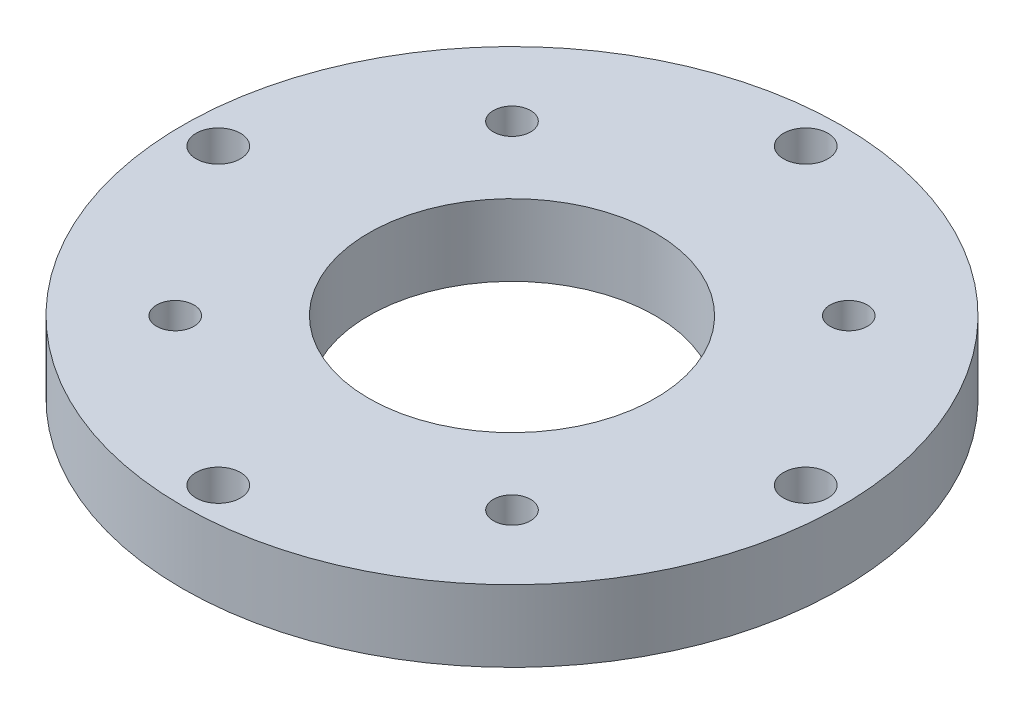
from build123d import *

# Parameters (mm, degrees)
SKETCH_1_R      = 46
SKETCH_1_R_2    = 20
SKETCH_1_R_3    = 3.1
EXTRUDE_1_DEPTH = 4
EXTRUDE_START   = 4
SKETCH_1_8_R    = 46
SKETCH_1_8_R_2  = 3.1
SKETCH_1_8_R_3  = 20
SKETCH_1_8_R_4  = 2.6
EXTRUDE_3_DEPTH = 6


with BuildPart() as part:
    # 草图1 → 凸台-拉伸1 (new body)
    with BuildSketch(Plane(origin=(0, 0, 0), x_dir=(1, 0, 0), z_dir=(0, 1, 0))):
        with Locations(Location((0, 0, 0), (0, 0, 270))):
            Circle(SKETCH_1_R)
        with Locations(Location((0, 0, 0), (0, 0, 270))):
            Circle(SKETCH_1_R_2, mode=Mode.SUBTRACT)
        with Locations(Location((0, 41, 0), (0, 0, 270))):
            Circle(SKETCH_1_R_3, mode=Mode.SUBTRACT)
        with Locations(Location((41, 0, 0), (0, 0, 270))):
            Circle(SKETCH_1_R_3, mode=Mode.SUBTRACT)
        with Locations(Location((0, -41, 0), (0, 0, 270))):
            Circle(SKETCH_1_R_3, mode=Mode.SUBTRACT)
        with Locations(Location((-41, 0, 0), (0, 0, 270))):
            Circle(SKETCH_1_R_3, mode=Mode.SUBTRACT)
        Polygon((-19.45, 21.16173141), (-19.45, 25.83826859), (-23.5, 28.17653718), (-27.55, 25.83826859), (-27.55, 21.16173141), (-23.5, 18.82346282), align=None, mode=Mode.SUBTRACT)
        Polygon((21.16173141, 19.45), (25.83826859, 19.45), (28.17653718, 23.5), (25.83826859, 27.55), (21.16173141, 27.55), (18.82346282, 23.5), align=None, mode=Mode.SUBTRACT)
        Polygon((19.45, -21.16173141), (19.45, -25.83826859), (23.5, -28.17653718), (27.55, -25.83826859), (27.55, -21.16173141), (23.5, -18.82346282), align=None, mode=Mode.SUBTRACT)
        Polygon((-21.16173141, -19.45), (-25.83826859, -19.45), (-28.17653718, -23.5), (-25.83826859, -27.55), (-21.16173141, -27.55), (-18.82346282, -23.5), align=None, mode=Mode.SUBTRACT)
    extrude(amount=EXTRUDE_1_DEPTH)

    # 草图1<8> → 凸台-拉伸3 (add)
    # profile 1 of 5: a face of its own
    with BuildSketch(Plane(origin=(0, 0, 0), x_dir=(1, 0, 0), z_dir=(0, 1, 0)).offset(EXTRUDE_START)):
        with Locations(Location((0, 0, 0), (0, 0, 270))):
            Circle(SKETCH_1_8_R)
        with Locations(Location((-41, 0, 0), (0, 0, 270))):
            Circle(SKETCH_1_8_R_2, mode=Mode.SUBTRACT)
        with Locations(Location((0, -41, 0), (0, 0, 270))):
            Circle(SKETCH_1_8_R_2, mode=Mode.SUBTRACT)
        with Locations(Location((41, 0, 0), (0, 0, 270))):
            Circle(SKETCH_1_8_R_2, mode=Mode.SUBTRACT)
        with Locations(Location((0, 41, 0), (0, 0, 270))):
            Circle(SKETCH_1_8_R_2, mode=Mode.SUBTRACT)
        with Locations(Location((0, 0, 0), (0, 0, 270))):
            Circle(SKETCH_1_8_R_3, mode=Mode.SUBTRACT)
        Polygon((-23.5, 18.82346282), (-19.45, 21.16173141), (-19.45, 25.83826859), (-23.5, 28.17653718), (-27.55, 25.83826859), (-27.55, 21.16173141), align=None, mode=Mode.SUBTRACT)
        Polygon((18.82346282, 23.5), (21.16173141, 19.45), (25.83826859, 19.45), (28.17653718, 23.5), (25.83826859, 27.55), (21.16173141, 27.55), align=None, mode=Mode.SUBTRACT)
        Polygon((23.5, -18.82346282), (19.45, -21.16173141), (19.45, -25.83826859), (23.5, -28.17653718), (27.55, -25.83826859), (27.55, -21.16173141), align=None, mode=Mode.SUBTRACT)
        Polygon((-18.82346282, -23.5), (-21.16173141, -19.45), (-25.83826859, -19.45), (-28.17653718, -23.5), (-25.83826859, -27.55), (-21.16173141, -27.55), align=None, mode=Mode.SUBTRACT)
    # profile 2 of 5: a face of its own
    with BuildSketch(Plane(origin=(0, 0, 0), x_dir=(1, 0, 0), z_dir=(0, 1, 0)).offset(EXTRUDE_START)):
        Polygon((-21.16173141, -27.55), (-18.82346282, -23.5), (-21.16173141, -19.45), (-25.83826859, -19.45), (-28.17653718, -23.5), (-25.83826859, -27.55), align=None)
        with Locations(Location((-23.5, -23.5, 0), (0, 0, 270))):
            Circle(SKETCH_1_8_R_4, mode=Mode.SUBTRACT)
    # profile 3 of 5: a face of its own
    with BuildSketch(Plane(origin=(0, 0, 0), x_dir=(1, 0, 0), z_dir=(0, 1, 0)).offset(EXTRUDE_START)):
        Polygon((27.55, -21.16173141), (23.5, -18.82346282), (19.45, -21.16173141), (19.45, -25.83826859), (23.5, -28.17653718), (27.55, -25.83826859), align=None)
        with Locations(Location((23.5, -23.5, 0), (0, 0, 270))):
            Circle(SKETCH_1_8_R_4, mode=Mode.SUBTRACT)
    # profile 4 of 5: a face of its own
    with BuildSketch(Plane(origin=(0, 0, 0), x_dir=(1, 0, 0), z_dir=(0, 1, 0)).offset(EXTRUDE_START)):
        Polygon((21.16173141, 27.55), (18.82346282, 23.5), (21.16173141, 19.45), (25.83826859, 19.45), (28.17653718, 23.5), (25.83826859, 27.55), align=None)
        with Locations(Location((23.5, 23.5, 0), (0, 0, 270))):
            Circle(SKETCH_1_8_R_4, mode=Mode.SUBTRACT)
    # profile 5 of 5: a face of its own
    with BuildSketch(Plane(origin=(0, 0, 0), x_dir=(1, 0, 0), z_dir=(0, 1, 0)).offset(EXTRUDE_START)):
        Polygon((-27.55, 21.16173141), (-23.5, 18.82346282), (-19.45, 21.16173141), (-19.45, 25.83826859), (-23.5, 28.17653718), (-27.55, 25.83826859), align=None)
        with Locations(Location((-23.5, 23.5, 0), (0, 0, 270))):
            Circle(SKETCH_1_8_R_4, mode=Mode.SUBTRACT)
    extrude(amount=EXTRUDE_3_DEPTH)


solid = part.part
